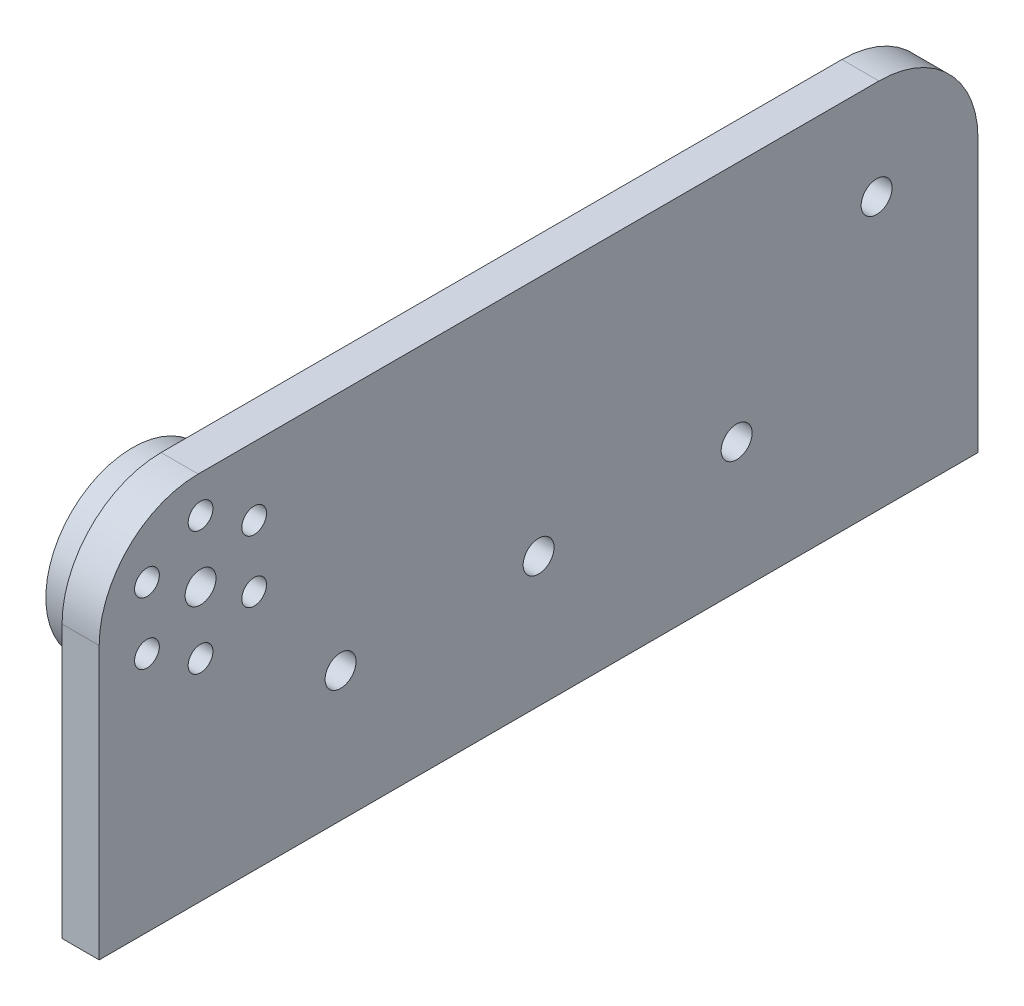
from build123d import *

# Parameters (mm, degrees)
SKETCH1_W           = 71
SKETCH1_H           = 30
BOSS_EXTRUDE1_DEPTH = 3
SKETCH2_R           = 1.25
CUT_EXTRUDE1_DEPTH  = 5
FILLET1_R           = 8
SKETCH3_R           = 7
SKETCH3_R_2         = 1.25
BOSS_EXTRUDE2_DEPTH = 2.5
SKETCH4_R           = 1
CUT_EXTRUDE2_DEPTH  = 10
CIRPATTERN1_COUNT   = 6


with BuildPart() as part:
    # Sketch1 → Boss-Extrude1 (new body)
    with BuildSketch(Plane(origin=(0, 0, 0), x_dir=(0, 0, -1), z_dir=(1, 0, 0))):
        Rectangle(SKETCH1_W, SKETCH1_H)
    extrude(amount=BOSS_EXTRUDE1_DEPTH)

    # Sketch2 → Cut-Extrude1 (cut)
    with BuildSketch(Plane(origin=(3, 0, 0), x_dir=(0, 0, -1), z_dir=(1, 0, 0))):
        with Locations((-27.31, 7)):
            Circle(SKETCH2_R)
        with Locations((0, -4.5)):
            Circle(SKETCH2_R)
        with Locations((-16, -4.5)):
            Circle(SKETCH2_R)
    cut_extrude1 = extrude(amount=-CUT_EXTRUDE1_DEPTH, mode=Mode.SUBTRACT)

    # Mirror1: Cut-Extrude1 across plane
    add(cut_extrude1.mirror(Plane.XY), mode=Mode.SUBTRACT)

    # Fillet1
    fillet1_edges = [part.edges().sort_by_distance(p)[0] for p in [
        (1.5, 15, 35.5),
        (1.5, 15, -35.5),
    ]]
    fillet(fillet1_edges, radius=FILLET1_R)

    # Sketch3 → Boss-Extrude2 (add)
    with BuildSketch(Plane(origin=(0, 0, 0), x_dir=(0, 0, -1), z_dir=(1, 0, 0))):
        with Locations((-27.31, 7)):
            Circle(SKETCH3_R)
        with Locations((-27.31, 7)):
            Circle(SKETCH3_R_2, mode=Mode.SUBTRACT)
    extrude(amount=-BOSS_EXTRUDE2_DEPTH)

    # Sketch4 → Cut-Extrude2 (cut)
    with BuildSketch(Plane.ZY.offset(2.5)):
        with Locations((27.31, 12)):
            Circle(SKETCH4_R)
    cut_extrude2 = extrude(amount=-CUT_EXTRUDE2_DEPTH, mode=Mode.SUBTRACT)

    # CirPattern1: Cut-Extrude2 ×6 about axis
    cirpattern1_axis = Axis((0, 7, 27.31), (1, 0, 0))
    for i in range(1, CIRPATTERN1_COUNT):
        add(cut_extrude2.rotate(cirpattern1_axis, i * 360 / CIRPATTERN1_COUNT), mode=Mode.SUBTRACT)


solid = part.part
